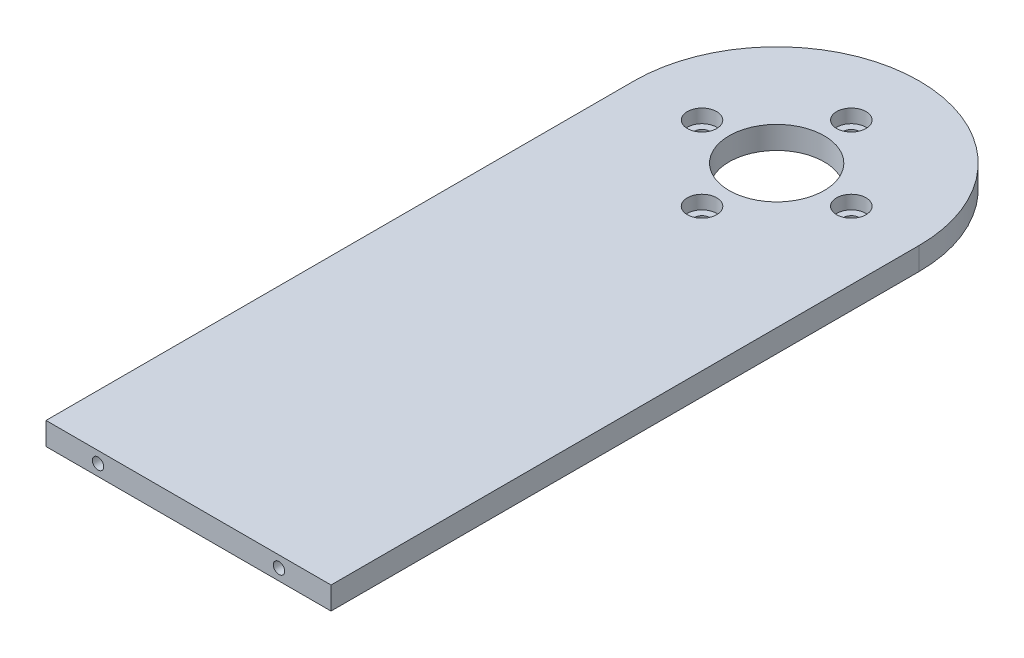
from build123d import *

# Parameters (mm, degrees)
BOSS_EXTRUDE1_DEPTH            = 5
M3X0_5_TAPPED_HOLE1_D          = 2.5
M3X0_5_TAPPED_HOLE1_DEPTH      = 7.5
M3X0_5_TAPPED_HOLE1_TIP        = 0.751075774
CBORE_FOR_M3_SHCS1_D           = 3.4
CBORE_FOR_M3_SHCS1_CBORE_D     = 6.5
CBORE_FOR_M3_SHCS1_CBORE_DEPTH = 3
SKETCH6_R                      = 10.5
CUT_EXTRUDE1_DEPTH             = 174.42505586


with BuildPart() as part:
    # Sketch1 → Boss-Extrude1 (new body)
    with BuildSketch(Plane(origin=(0, 0, 0), x_dir=(1, 0, 0), z_dir=(0, 1, 0))):
        with BuildLine():
            Line((0, 0), (63, 0))
            Line((63, 0), (63, 130))
            ThreePointArc((63, 130), (31.5, 161.5), (0, 130))
            Line((0, 130), (0, 0))
        make_face()
    extrude(amount=BOSS_EXTRUDE1_DEPTH)

    # M3x0.5 Tapped Hole1
    with Locations(Plane.XY):
        with Locations((11.5, 2.5), (51.5, 2.5)):
            Hole(M3X0_5_TAPPED_HOLE1_D / 2, depth=M3X0_5_TAPPED_HOLE1_DEPTH)
            with Locations((0, 0, -(M3X0_5_TAPPED_HOLE1_DEPTH + M3X0_5_TAPPED_HOLE1_TIP / 2))):  # 118° drill point
                Cone(0, M3X0_5_TAPPED_HOLE1_D / 2, M3X0_5_TAPPED_HOLE1_TIP, mode=Mode.SUBTRACT)

    # CBORE for M3 SHCS1 (through all)
    with Locations(Plane(origin=(0, 5, 0), x_dir=(1, 0, 0), z_dir=(0, 1, 0))):
        with Locations((31.5, 113.5), (15, 130), (48, 130), (31.5, 146.5)):
            CounterBoreHole(CBORE_FOR_M3_SHCS1_D / 2, CBORE_FOR_M3_SHCS1_CBORE_D / 2, CBORE_FOR_M3_SHCS1_CBORE_DEPTH)

    # Sketch6 → Cut-Extrude1 (cut, through all)
    with BuildSketch(Plane(origin=(0, 5, 0), x_dir=(1, 0, 0), z_dir=(0, 1, 0))):
        with Locations(Location((31.5, 130, 0), (0, 0, 270))):
            Circle(SKETCH6_R)
    extrude(amount=-CUT_EXTRUDE1_DEPTH, mode=Mode.SUBTRACT)


solid = part.part
